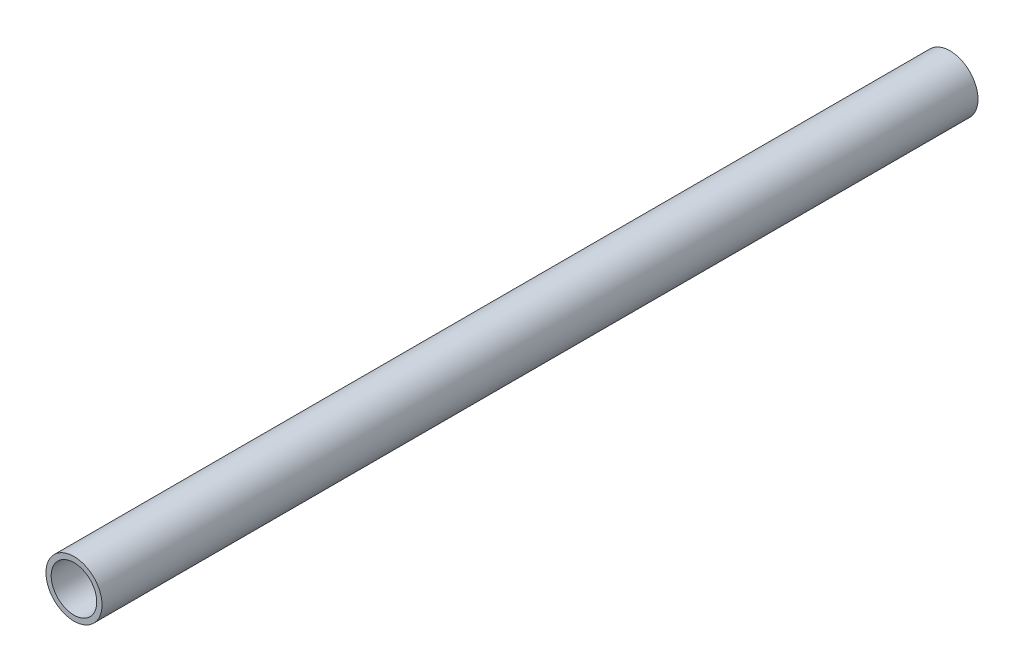
from build123d import *

# Parameters (mm, degrees)
CROQUIS1_R     = 16
EXTRUIR1_DEPTH = 250
VACIADO1_T     = -3


with BuildPart() as part:
    # Croquis1 → Extruir1 (new, symmetric)
    with BuildSketch(Plane.XY):
        Circle(CROQUIS1_R)
    extrude(amount=EXTRUIR1_DEPTH, both=True)

    # Vaciado1
    vaciado1_openings = [part.faces().sort_by_distance(p)[0] for p in [
        (0, 0, 250),
        (0, 0, -250),
    ]]
    offset(amount=VACIADO1_T, openings=vaciado1_openings, kind=Kind.INTERSECTION)


solid = part.part
